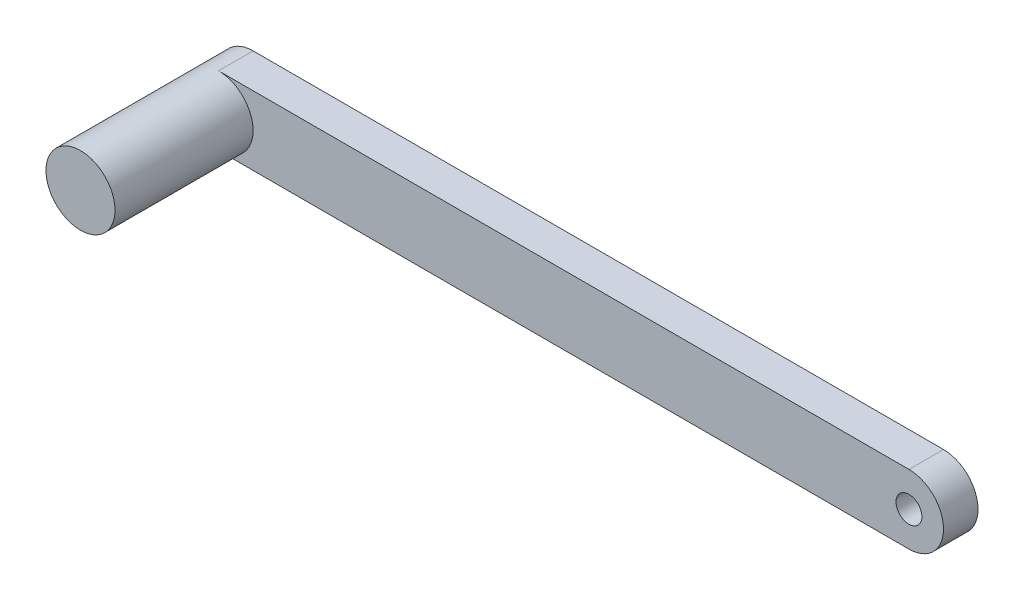
from build123d import *

# Parameters (mm, degrees)
BOSS_EXTRUDE1_DEPTH   = 2
SKETCH2_R             = 2
BOSS_EXTRUDE2_DEPTH   = 8
CROQUIS1_R            = 0.75
CORTAR_EXTRUIR1_DEPTH = 10


with BuildPart() as part:
    # Sketch1 → Boss-Extrude1 (new body)
    with BuildSketch(Plane.XY):
        with BuildLine():
            Line((0, -2), (40, -2))
            ThreePointArc((40, -2), (42, 0), (40, 2))
            Line((40, 2), (0, 2))
            ThreePointArc((0, 2), (-2, 0), (0, -2))
        make_face()
    extrude(amount=BOSS_EXTRUDE1_DEPTH)

    # Sketch2 → Boss-Extrude2 (add)
    with BuildSketch(Plane.XY.offset(2)):
        with Locations(Location((0, 0, 0), (0, 0, 270))):
            Circle(SKETCH2_R)
    extrude(amount=BOSS_EXTRUDE2_DEPTH)

    # Croquis1 → Cortar-Extruir1 (cut)
    with BuildSketch(Plane.XY.offset(2)):
        with Locations((40, 0)):
            Circle(CROQUIS1_R)
    extrude(amount=-CORTAR_EXTRUIR1_DEPTH, mode=Mode.SUBTRACT)


solid = part.part
